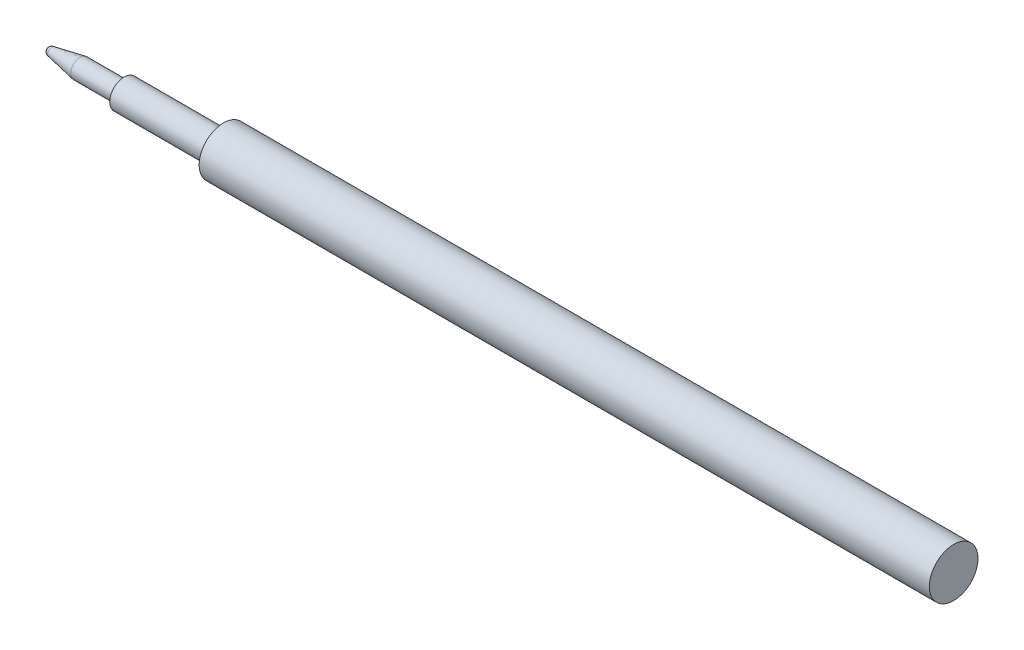
from build123d import *


with BuildPart() as part:
    # Sketch1 → Revolve1 (revolve)
    with BuildSketch(Plane.XY):
        with BuildLine():
            Line((-90, 3), (-90, 1.77))
            Line((-90, 1.77), (-102.25, 1.77))
            Line((-102.25, 1.77), (-102.25, 1.16))
            Line((-102.25, 1.16), (-107.67, 1.16))
            Line((-107.67, 1.16), (-111.17, 0.5))
            ThreePointArc((-111.17, 0.5), (-111.523553391, 0.353553391), (-111.67, 0))
            Line((-111.67, 0), (0, 0))
            Line((0, 0), (0, 3))
            Line((0, 3), (-90, 3))
        make_face()
    revolve(axis=Axis((0, 0, 0), (-1, 0, 0)))


solid = part.part
